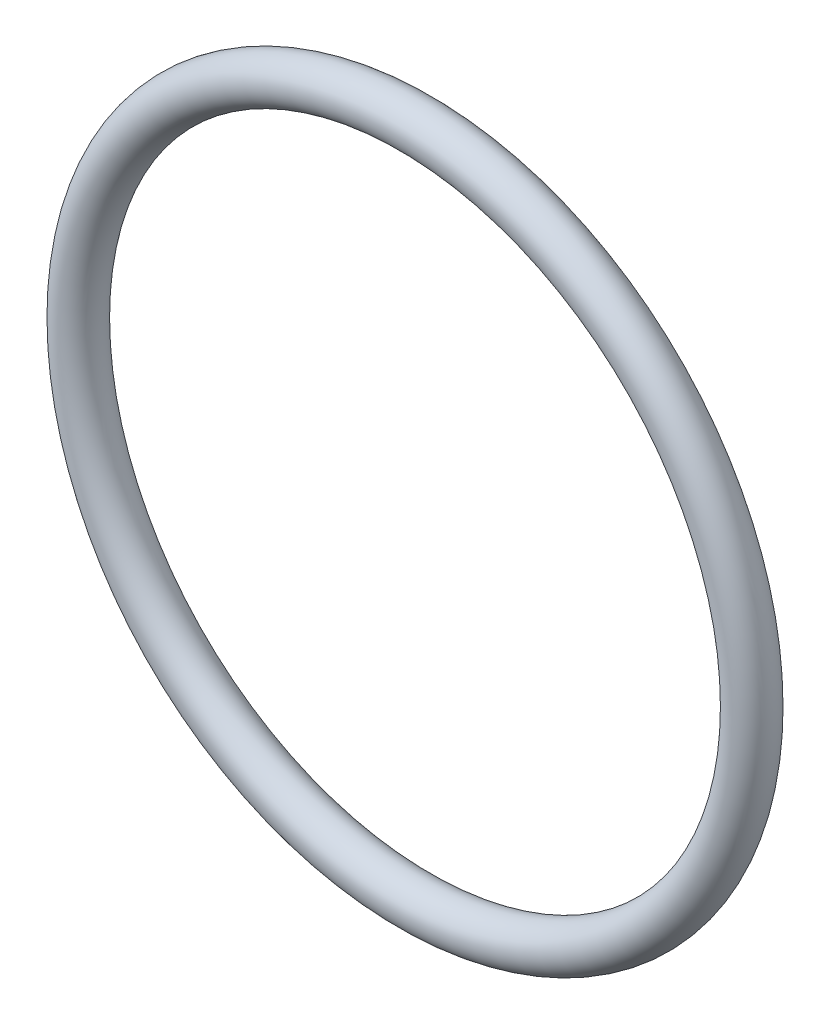
from build123d import *

# Parameters (mm, degrees)
SKETCH3_R = 1.5875


with BuildPart() as part:
    # Sketch3 → Revolve1 (revolve)
    with BuildSketch(Plane(origin=(0, 0, 0), x_dir=(1, 0, 0), z_dir=(0, 1, 0))):
        with Locations((24.13, 0)):
            Circle(SKETCH3_R)
    revolve(axis=Axis((0, 0, 0), (0, 0, -1)))


solid = part.part
